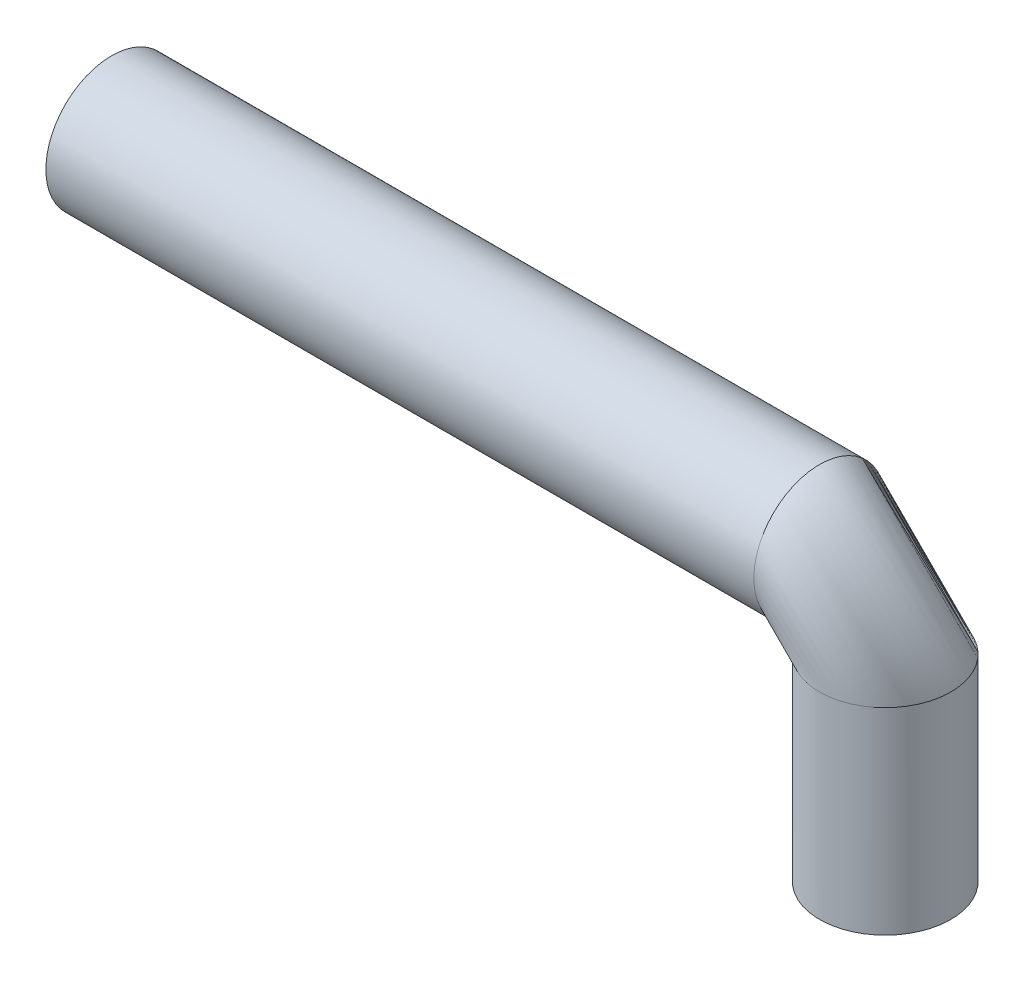
from build123d import *

# Parameters (mm, degrees)
SKETCH3_R = 1.5875


with BuildPart() as part:
    # Sweep1: sweep along a path in Sketch2
    with BuildLine(Plane.XY) as sweep1_path:
        Line((0, 0), (17.11325, 0))
        ThreePointArc((17.11325, 0), (18.235782015, -0.464967985), (18.70075, -1.5875))
        Line((18.70075, -1.5875), (18.70075, -6.35))
    # Sketch3 → Sweep1 (sweep)
    with BuildSketch(Plane(origin=(0, 0, 0), x_dir=(0, 0, -1), z_dir=(1, 0, 0))):
        Circle(SKETCH3_R)
    sweep(path=sweep1_path.line)


solid = part.part
